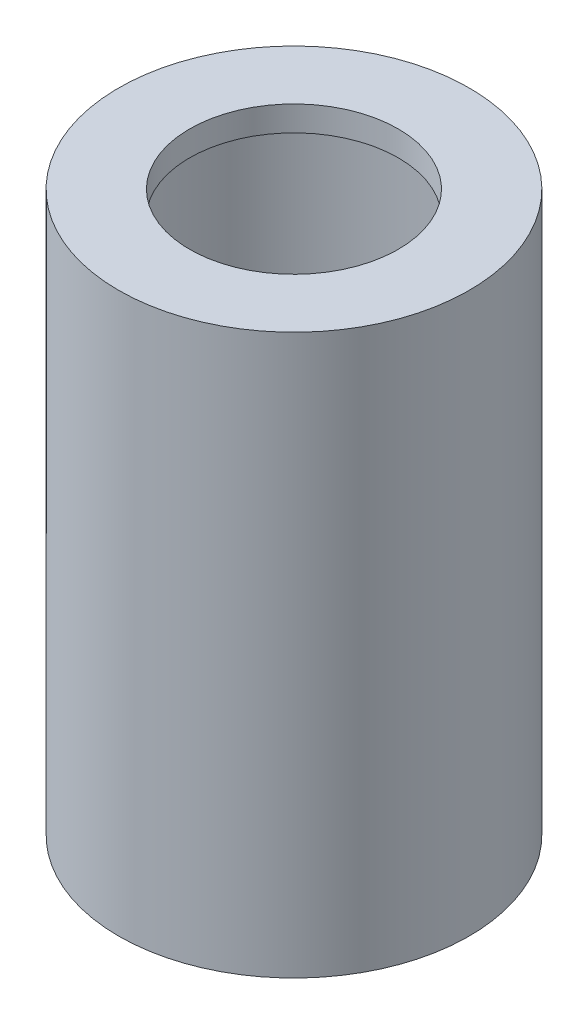
from build123d import *

# Parameters (mm, degrees)
SKETCH1_R           = 26.67
BOSS_EXTRUDE1_DEPTH = 81.28
SHELL1_T            = -2.54
SKETCH2_R           = 26.67
SKETCH2_R_2         = 15.875
BOSS_EXTRUDE2_DEPTH = 3.81


with BuildPart() as part:
    # Sketch1 → Boss-Extrude1 (new body)
    with BuildSketch(Plane(origin=(0, 0, 0), x_dir=(1, 0, 0), z_dir=(0, 1, 0))):
        with Locations(Location((0, 0, 0), (0, 0, 270))):
            Circle(SKETCH1_R)
    extrude(amount=BOSS_EXTRUDE1_DEPTH)

    # Shell1
    shell1_openings = [part.faces().sort_by_distance(p)[0] for p in [
        (0, 81.28, 0),
    ]]
    offset(amount=SHELL1_T, openings=shell1_openings, kind=Kind.INTERSECTION)

    # Sketch2 → Boss-Extrude2 (add)
    with BuildSketch(Plane(origin=(0, 81.28, 0), x_dir=(1, 0, 0), z_dir=(0, 1, 0))):
        with Locations(Location((0, 0, 0), (0, 0, 270))):
            Circle(SKETCH2_R)
        with Locations(Location((0, 0, 0), (0, 0, 90))):
            Circle(SKETCH2_R_2, mode=Mode.SUBTRACT)
    extrude(amount=BOSS_EXTRUDE2_DEPTH)


solid = part.part
